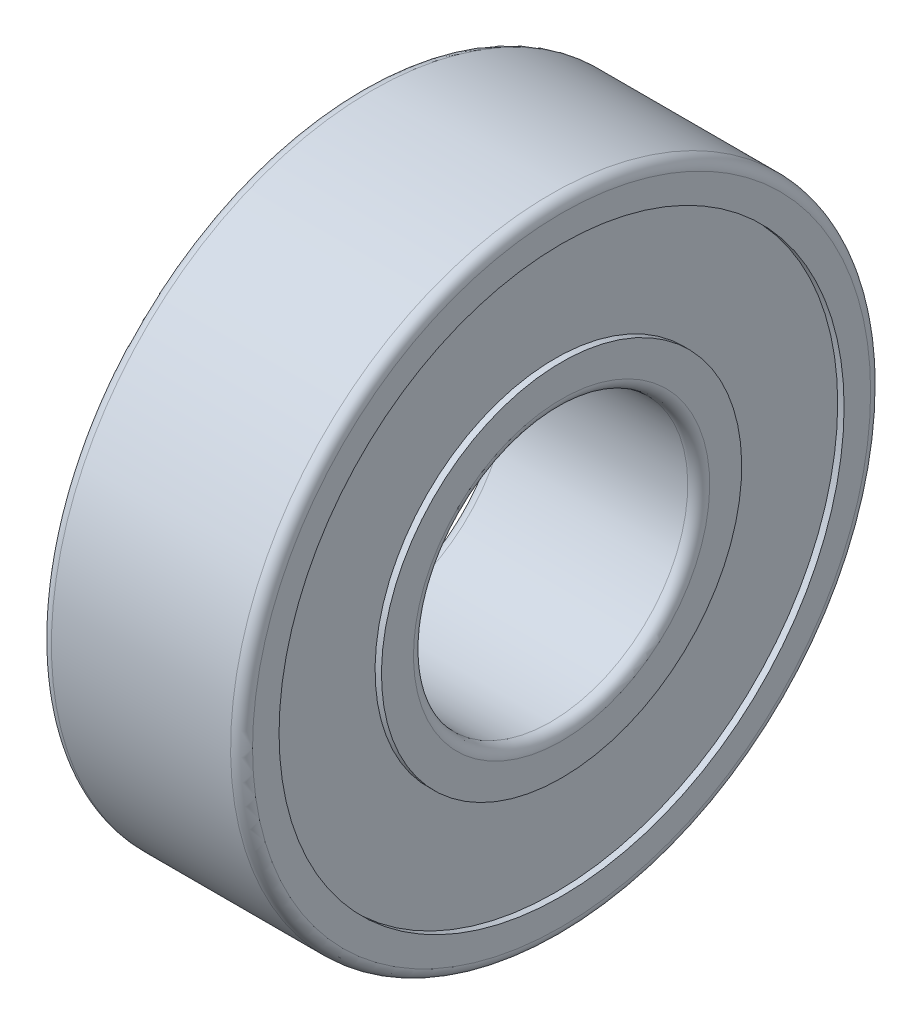
from build123d import *

# Parameters (mm, degrees)
FILLET1_R = 0.6


with BuildPart() as part:
    # Sketch1 → Revolve1 (revolve)
    with BuildSketch(Plane.XY, mode=Mode.PRIVATE) as revolve1_sk:
        Polygon((0, 17.5), (11, 17.5), (11, 15.45), (10.65, 15.45), (10.65, 9.85), (11, 9.85), (11, 7.5), (0, 7.5), (0, 9.85), (0.35, 9.85), (0.35, 15.45), (0, 15.45), align=None)
    revolve(revolve1_sk.sketch.rotate(Axis((0, 0, 0), (1, 0, 0)), 180), axis=Axis((0, 0, 0), (1, 0, 0)))

    # Fillet1
    fillet1_edges = [part.edges().sort_by_distance(p)[0] for p in [
        (0, 7.5, 0),
        (11, 7.5, 0),
        (11, 17.5, 0),
        (0, 17.5, 0),
    ]]
    fillet(fillet1_edges, radius=FILLET1_R)


solid = part.part
